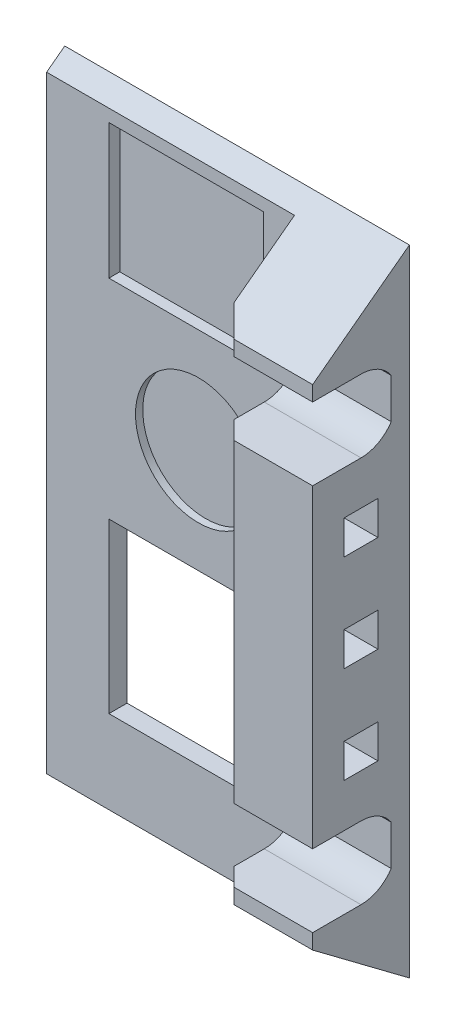
from build123d import *
from build123d.topology import SkipClean

# Parameters (mm, degrees)
ESBO_O1_R                 = 8.3
RESSALTO_EXTRUS_O1_DEPTH  = 1.5
RESSALTO_EXTRUS_O2_DEPTH  = 6
ESBO_O3_W                 = 2.8
ESBO_O3_H                 = 2.8
CORTE_EXTRUS_O1_DEPTH     = 37.142080737
ESBO_O4_W                 = 2.8
ESBO_O4_H                 = 2.8
CORTE_EXTRUS_O2_DEPTH     = 53.08166664
ESBO_O6_W                 = 5
ESBO_O6_H                 = 25
RESSALTO_EXTRUS_O5_DEPTH  = 7.5
ESBO_O7_W                 = 2.8
ESBO_O7_H                 = 2.8
CORTE_EXTRUS_O3_DEPTH     = 60
RESSALTO_EXTRUS_O3_DEPTH  = 10
ESBO_O8_W                 = 60
ESBO_O8_H                 = 52.5
ESBO_O8_R                 = 8.3
RESSALTO_EXTRUS_O6_DEPTH  = 1.5
CORTE_EXTRUS_O4_DEPTH     = 42.098205557
RESSALTO_EXTRUS_O7_DEPTH  = 6.5
ESBO_O14_W                = 5.7
ESBO_O14_H                = 52.5
CORTE_EXTRUS_O8_DEPTH     = 4.5
CORTE_EXTRUS_O9_DEPTH     = 41.657871317
CORTE_EXTRUS_O13_DEPTH    = 6.25
CORTE_EXTRUS_O14_DEPTH    = 6.25
ESBO_O12_R                = 1.65
CORTE_EXTRUS_O15_DEPTH    = 4.5
CORTE_EXTRUS_O17_DEPTH    = 62.398717413
ESBO_O20_R                = 3.5
CORTE_EXTRUS_O18_DEPTH    = 5
RESSALTO_EXTRUS_O8_START  = 2.95
ESBO_O21_R                = 1.65
RESSALTO_EXTRUS_O8_DEPTH  = 2.95
ESBO_O22_W                = 2.8
ESBO_O22_H                = 2.8
RESSALTO_EXTRUS_O9_DEPTH  = 1.25
CORTE_EXTRUS_O19_DEPTH    = 6
ESBO_O24_W                = 8
ESBO_O24_H                = 50.25
RESSALTO_EXTRUS_O10_DEPTH = 6.5
CORTE_EXTRUS_O20_DEPTH    = 62.222570389
CORTE_EXTRUS_O21_REACH    = 67.143
ESBO_O26_W                = 2.8
ESBO_O26_H                = 2.8
CORTE_EXTRUS_O22_REACH    = 67.143
CORTE_EXTRUS_O23_DEPTH    = 6.5
CORTE_EXTRUS_O24_DEPTH    = 6.5
CORTE_EXTRUS_O25_START    = -6.5
CORTE_EXTRUS_O25_DEPTH    = 6.5
CORTE_EXTRUS_O26_DEPTH    = 4.95
ESBO_O33_R                = 9.3
CORTE_EXTRUS_O27_DEPTH    = 43.019340785
ESBO_O34_R                = 8.3
RESSALTO_EXTRUS_O11_DEPTH = 1.5
ESBO_O49_R                = 41.403192139
CORTE_EXTRUS_O37_DEPTH    = 28.5
ESBO_O50_W                = 12.795
ESBO_O50_H                = 13.938
ESBO_O50_H_2              = 11.144
CORTE_EXTRUS_O38_DEPTH    = 42.588760501
ESBO_O51_R                = 5.2
CORTE_EXTRUS_O39_DEPTH    = 0.6
ESBO_O52_R                = 31.470560184
CORTE_EXTRUS_O40_DEPTH    = 1.5
ESBO_O54_R                = 5
ESBO_O54_R_2              = 3
CORTE_EXTRUS_O41_DEPTH    = 0.3
ESBO_O56_W                = 12.795
ESBO_O56_H                = 11.144
RESSALTO_EXTRUS_O13_DEPTH = 0.6
ESBO_O57_W                = 12.795
ESBO_O57_H                = 11.144
ESBO_O57_W_2              = 12.195
ESBO_O57_H_2              = 10.544
CORTE_EXTRUS_O44_DEPTH    = 0.3


with BuildPart() as part:
    # Esboço1 → Ressalto-extrusão1 (new body)
    with BuildSketch(Plane.XY):
        Polygon((-25, -12.5), (-25, 12.5), (25, 12.5), (25, -12.5), (15, -12.5), (-15, -12.5), align=None)
        with Locations((-13, 0)):
            Circle(ESBO_O1_R, mode=Mode.SUBTRACT)
        with Locations(Location((13, 0, 0), (0, 0, 180))):
            Circle(ESBO_O1_R, mode=Mode.SUBTRACT)
    extrude(amount=RESSALTO_EXTRUS_O1_DEPTH)

    # Esboço2 → Ressalto-extrusão2 (add)
    with BuildSketch(Plane.XY.offset(1.5)):
        Polygon((-20, -12.5), (-25, -12.5), (-25, -2.5), (-22, -2.5), (-22, -9.5), (-15, -9.5), (-15, -12.5), align=None)
        Polygon((22, -2.5), (22, -9.5), (15, -9.5), (15, -12.5), (20, -12.5), (25, -12.5), (25, -2.5), align=None)
        Polygon((20, 12.5), (25, 12.5), (25, 2.5), (22, 2.5), (22, 9.5), (15, 9.5), (15, 12.5), align=None)
        Polygon((-22, 2.5), (-22, 9.5), (-15, 9.5), (-15, 12.5), (-20, 12.5), (-25, 12.5), (-25, 2.5), align=None)
    extrude(amount=RESSALTO_EXTRUS_O2_DEPTH)

    # Esboço3 → Corte-extrusão1 (cut, through all)
    with BuildSketch(Plane.XZ.offset(12.5)):
        with Locations((-20, 3.75)):
            Rectangle(ESBO_O3_W, ESBO_O3_H)
        with Locations((20, 3.75)):
            Rectangle(ESBO_O3_W, ESBO_O3_H)
    extrude(amount=-CORTE_EXTRUS_O1_DEPTH, mode=Mode.SUBTRACT)

    # Esboço4 → Corte-extrusão2 (cut, through all)
    with BuildSketch(Plane.ZY.offset(25)):
        with Locations((3.75, 7.5)):
            Rectangle(ESBO_O4_W, ESBO_O4_H)
        with Locations((3.75, -7.5)):
            Rectangle(ESBO_O4_W, ESBO_O4_H)
    extrude(amount=-CORTE_EXTRUS_O2_DEPTH, mode=Mode.SUBTRACT)

    # Esboço6 → Ressalto-extrusão5 (add)
    with BuildSketch(Plane(origin=(0, 0, 0), x_dir=(-1, 0, 0), z_dir=(0, 0, -1))):
        with Locations((-27.5, 0)):
            Rectangle(ESBO_O6_W, ESBO_O6_H)
        with Locations((27.5, 0)):
            Rectangle(ESBO_O6_W, ESBO_O6_H)
    extrude(amount=-RESSALTO_EXTRUS_O5_DEPTH)

    # Esboço7 → Corte-extrusão3 (cut)
    with BuildSketch(Plane(origin=(30, 0, 0), x_dir=(0, 0, -1), z_dir=(1, 0, 0))):
        with Locations((-3.75, -7.5)):
            Rectangle(ESBO_O7_W, ESBO_O7_H)
        with Locations((-3.75, 7.5)):
            Rectangle(ESBO_O7_W, ESBO_O7_H)
    extrude(amount=-CORTE_EXTRUS_O3_DEPTH, mode=Mode.SUBTRACT)

    # Esboço5 → Ressalto-extrusão3 (add)
    with SkipClean():  # the faces are left unmerged after this step: merging them gives an invalid solid
        with BuildSketch(Plane.XY.offset(1.5)):
            with BuildLine():
                Line((-9, -7.272551134), (-9, -8.395832299))
                ThreePointArc((-9, -8.395832299), (-3.7, 0), (-9, 8.395832299))
                Line((-9, 8.395832299), (-9, 7.272551134))
                ThreePointArc((-9, 7.272551134), (-4.7, 0), (-9, -7.272551134))
            make_face()
            with BuildLine():
                Line((-17, -7.272551134), (-17, -8.395832299))
                ThreePointArc((-17, -8.395832299), (-22.3, 0), (-17, 8.395832299))
                Line((-17, 8.395832299), (-17, 7.272551134))
                ThreePointArc((-17, 7.272551134), (-21.3, 0), (-17, -7.272551134))
            make_face()
            with BuildLine():
                Line((9, -7.272551134), (9, -8.395832299))
                ThreePointArc((9, -8.395832299), (3.7, 0), (9, 8.395832299))
                Line((9, 8.395832299), (9, 7.272551134))
                ThreePointArc((9, 7.272551134), (4.7, 0), (9, -7.272551134))
            make_face()
            with BuildLine():
                Line((17, 8.395832299), (17, 7.272551134))
                ThreePointArc((17, 7.272551134), (21.3, 0), (17, -7.272551134))
                Line((17, -7.272551134), (17, -8.395832299))
                ThreePointArc((17, -8.395832299), (22.3, 0), (17, 8.395832299))
            make_face()
        extrude(amount=RESSALTO_EXTRUS_O3_DEPTH)

    # Esboço8 → Ressalto-extrusão6 (add)
    with SkipClean():  # the faces are left unmerged after this step: merging them gives an invalid solid
        with BuildSketch(Plane(origin=(0, 0, 0), x_dir=(-1, 0, 0), z_dir=(0, 0, -1))):
            Rectangle(ESBO_O8_W, ESBO_O8_H)
            with Locations(Location((13, 0, 0), (0, 0, 298.811379709))):
                Circle(ESBO_O8_R, mode=Mode.SUBTRACT)
            with Locations((-13, 0)):
                Circle(ESBO_O8_R, mode=Mode.SUBTRACT)
        extrude(amount=-RESSALTO_EXTRUS_O6_DEPTH)

    # Esboço9 → Corte-extrusão4 (cut, through all)
    with SkipClean():  # the faces are left unmerged after this step: merging them gives an invalid solid
        with BuildSketch(Plane.XY.offset(1.5)):
            Polygon((-15, -12.5), (-15, -9.5), (-22, -9.5), (-22, -2.5), (-25, -2.5), (-25, 2.5), (-22, 2.5), (-22, 9.5), (-15, 9.5), (-15, 12.5), (-30, 12.5), (-30, -12.5), align=None)
        extrude(amount=CORTE_EXTRUS_O4_DEPTH, mode=Mode.SUBTRACT)

    # Esboço10 → Ressalto-extrusão7 (add)
    with SkipClean():  # the faces are left unmerged after this step: merging them gives an invalid solid
        with BuildSketch(Plane.XY.offset(1.5)):
            Polygon((-24.3, -26.25), (-24.3, 26.25), (-22.3, 26.25), (-17.3, 26.25), (-17.3, 20), (-22.3, 20), (-22.3, 12), (-17.3, 12), (-17.3, -12), (-22.3, -12), (-22.3, -20), (-17.3, -20), (-17.3, -26.25), (-22.3, -26.25), align=None)
        extrude(amount=RESSALTO_EXTRUS_O7_DEPTH)

    # Esboço14 → Corte-extrusão8 (cut)
    with SkipClean():  # the faces are left unmerged after this step: merging them gives an invalid solid
        with BuildSketch(Plane.XY.offset(1.5)):
            with Locations((-27.15, 0)):
                Rectangle(ESBO_O14_W, ESBO_O14_H)
        extrude(amount=-CORTE_EXTRUS_O8_DEPTH, mode=Mode.SUBTRACT)

    # Esboço15 → Corte-extrusão9 (cut, through all)
    with SkipClean():  # the faces are left unmerged after this step: merging them gives an invalid solid
        with BuildSketch(Plane.XY.offset(8)):
            with BuildLine():
                Line((-17.3, -7.09929574), (-17.3, 7.09929574))
                ThreePointArc((-17.3, 7.09929574), (-21.3, 0), (-17.3, -7.09929574))
            make_face()
        extrude(amount=-CORTE_EXTRUS_O9_DEPTH, mode=Mode.SUBTRACT)

    # Esboço11 → Corte-extrusão13 (cut)
    with SkipClean():  # the faces are left unmerged after this step: merging them gives an invalid solid
        with BuildSketch(Plane.XZ.offset(26.25)):
            Polygon((-22.3, 8), (-17.3, 8), (-17.3, 1.5), align=None)
        extrude(amount=-CORTE_EXTRUS_O13_DEPTH, mode=Mode.SUBTRACT)

    # Esboço17 → Corte-extrusão14 (cut)
    with SkipClean():  # the faces are left unmerged after this step: merging them gives an invalid solid
        with BuildSketch(Plane(origin=(0, 26.25, 0), x_dir=(1, 0, 0), z_dir=(0, 1, 0))):
            Polygon((-17.3, -1.5), (-17.3, -8), (-22.3, -8), align=None)
        extrude(amount=-CORTE_EXTRUS_O14_DEPTH, mode=Mode.SUBTRACT)

    # Esboço12 → Corte-extrusão15 (cut)
    with SkipClean():  # the faces are left unmerged after this step: merging them gives an invalid solid
        with BuildSketch(Plane.ZY.offset(24.3)):
            with Locations(Location((4, 16, 0), (0, 0, 270))):
                Circle(ESBO_O12_R)
            with Locations((4, -16)):
                Circle(ESBO_O12_R)
        extrude(amount=-CORTE_EXTRUS_O15_DEPTH, mode=Mode.SUBTRACT)

    # Esboço19 → Corte-extrusão17 (cut, through all)
    with SkipClean():  # the faces are left unmerged after this step: merging them gives an invalid solid
        with BuildSketch(Plane.ZY.offset(24.3)):
            Polygon((0, 26.25), (8, 26.25), (8, 20.25), align=None)
            Polygon((8, -20.25), (0, -26.25), (8, -26.25), align=None)
        extrude(amount=-CORTE_EXTRUS_O17_DEPTH, mode=Mode.SUBTRACT)

    # Esboço20 → Corte-extrusão18 (cut)
    with SkipClean():  # the faces are left unmerged after this step: merging them gives an invalid solid
        with BuildSketch(Plane(origin=(-22.3, 0, 0), x_dir=(0, 0, -1), z_dir=(1, 0, 0))):
            with Locations((-4, -16)):
                Circle(ESBO_O20_R)
            with Locations((-4, 16)):
                Circle(ESBO_O20_R)
        extrude(amount=CORTE_EXTRUS_O18_DEPTH, mode=Mode.SUBTRACT)

    # Esboço21 → Ressalto-extrusão8 (add)
    with SkipClean():  # the faces are left unmerged after this step: merging them gives an invalid solid
        with BuildSketch(Plane.ZY.offset(24.3).offset(RESSALTO_EXTRUS_O8_START)):
            Polygon((0, 26.25), (0, -26.25), (8, -20.25), (8, 20.25), align=None)
            with Locations(Location((4, -16, 0), (0, 0, 270))):
                Circle(ESBO_O21_R, mode=Mode.SUBTRACT)
            with Locations(Location((4, 16, 0), (0, 0, 270))):
                Circle(ESBO_O21_R, mode=Mode.SUBTRACT)
        extrude(amount=-RESSALTO_EXTRUS_O8_DEPTH)

    # Esboço22 → Ressalto-extrusão9 (add)
    with SkipClean():  # the faces are left unmerged after this step: merging them gives an invalid solid
        with BuildSketch(Plane(origin=(30, 0, 0), x_dir=(0, 0, -1), z_dir=(1, 0, 0))):
            Polygon((-1.5, -25.125), (0, -26.25), (0, 26.25), (-1.5, 25.125), (-1.5, 12.5), (-7.5, 12.5), (-7.5, -12.5), (-1.5, -12.5), align=None)
            with Locations((-3.75, -7.5)):
                Rectangle(ESBO_O22_W, ESBO_O22_H, mode=Mode.SUBTRACT)
            with Locations((-3.75, 7.5)):
                Rectangle(ESBO_O22_W, ESBO_O22_H, mode=Mode.SUBTRACT)
        extrude(amount=RESSALTO_EXTRUS_O9_DEPTH)

    # Esboço23 → Corte-extrusão19 (cut)
    with SkipClean():  # the faces are left unmerged after this step: merging them gives an invalid solid
        with BuildSketch(Plane.XY.offset(7.5)):
            Polygon((25, -2.5), (22, -2.5), (22, -9.5), (15, -9.5), (15, -12.5), (31.25, -12.5), (31.25, 12.5), (15, 12.5), (15, 9.5), (22, 9.5), (22, 2.5), (25, 2.5), align=None)
        extrude(amount=-CORTE_EXTRUS_O19_DEPTH, mode=Mode.SUBTRACT)

    # Esboço24 → Ressalto-extrusão10 (add)
    with SkipClean():  # the faces are left unmerged after this step: merging them gives an invalid solid
        with BuildSketch(Plane.XY.offset(1.5)):
            with Locations((27.25, 0)):
                Rectangle(ESBO_O24_W, ESBO_O24_H)
        extrude(amount=RESSALTO_EXTRUS_O10_DEPTH)

    # Esboço25 → Corte-extrusão20 (cut, through all)
    with SkipClean():  # the faces are left unmerged after this step: merging them gives an invalid solid
        with BuildSketch(Plane(origin=(0, 25.125, 0), x_dir=(1, 0, 0), z_dir=(0, 1, 0))):
            Polygon((23.25, -6.5), (23.25, -8), (24.75, -8), align=None)
        extrude(amount=-CORTE_EXTRUS_O20_DEPTH, mode=Mode.SUBTRACT)

    # Esboço26 → Corte-extrusão21 (cut, up to next)
    with BuildSketch(Plane(origin=(31.25, 0, 0), x_dir=(0, 0, -1), z_dir=(1, 0, 0)), mode=Mode.PRIVATE) as corte_extrus_o21_sk1:
        with Locations((-4, 0)):
            Rectangle(ESBO_O26_W, ESBO_O26_H)
    corte_extrus_o21_tool1 = extrude(corte_extrus_o21_sk1.sketch, amount=-CORTE_EXTRUS_O21_REACH, mode=Mode.PRIVATE) & part.part
    # Esboço26 → Corte-extrusão21 (cut, up to next)
    with BuildSketch(Plane(origin=(31.25, 0, 0), x_dir=(0, 0, -1), z_dir=(1, 0, 0)), mode=Mode.PRIVATE) as corte_extrus_o21_sk2:
        with Locations((-4, -8)):
            Rectangle(ESBO_O26_W, ESBO_O26_H)
    corte_extrus_o21_tool2 = extrude(corte_extrus_o21_sk2.sketch, amount=-CORTE_EXTRUS_O21_REACH, mode=Mode.PRIVATE) & part.part
    # Esboço26 → Corte-extrusão21 (cut, up to next)
    with BuildSketch(Plane(origin=(31.25, 0, 0), x_dir=(0, 0, -1), z_dir=(1, 0, 0)), mode=Mode.PRIVATE) as corte_extrus_o21_sk3:
        with Locations((-4, 8)):
            Rectangle(ESBO_O26_W, ESBO_O26_H)
    corte_extrus_o21_tool3 = extrude(corte_extrus_o21_sk3.sketch, amount=-CORTE_EXTRUS_O21_REACH, mode=Mode.PRIVATE) & part.part
    add(corte_extrus_o21_tool1.solids().sort_by_distance((31.25, 0, 4))[0], mode=Mode.SUBTRACT)
    add(corte_extrus_o21_tool2.solids().sort_by_distance((31.25, -8, 4))[0], mode=Mode.SUBTRACT)
    add(corte_extrus_o21_tool3.solids().sort_by_distance((31.25, 8, 4))[0], mode=Mode.SUBTRACT)

    # Esboço27 → Corte-extrusão22 (cut, up to next)
    with BuildSketch(Plane(origin=(31.25, 0, 0), x_dir=(0, 0, -1), z_dir=(1, 0, 0)), mode=Mode.PRIVATE) as corte_extrus_o22_sk1:
        with BuildLine():
            Line((-4, 19), (-8, 19))
            Line((-8, 19), (-8, 13))
            Line((-8, 13), (-4, 13))
            ThreePointArc((-4, 13), (-2.581362835, 13.356617963), (-1.5, 14.341687605))
            Line((-1.5, 14.341687605), (-1.5, 17.658312395))
            ThreePointArc((-1.5, 17.658312395), (-2.581362835, 18.643382037), (-4, 19))
        make_face()
    corte_extrus_o22_tool1 = extrude(corte_extrus_o22_sk1.sketch, amount=-CORTE_EXTRUS_O22_REACH, mode=Mode.PRIVATE) & part.part
    # Esboço27 → Corte-extrusão22 (cut, up to next)
    with BuildSketch(Plane(origin=(31.25, 0, 0), x_dir=(0, 0, -1), z_dir=(1, 0, 0)), mode=Mode.PRIVATE) as corte_extrus_o22_sk2:
        Polygon((-8, -20.25), (-8, -25.125), (-1.5, -25.125), align=None)
    corte_extrus_o22_tool2 = extrude(corte_extrus_o22_sk2.sketch, amount=-CORTE_EXTRUS_O22_REACH, mode=Mode.PRIVATE) & part.part
    # Esboço27 → Corte-extrusão22 (cut, up to next)
    with BuildSketch(Plane(origin=(31.25, 0, 0), x_dir=(0, 0, -1), z_dir=(1, 0, 0)), mode=Mode.PRIVATE) as corte_extrus_o22_sk3:
        Polygon((-8, 25.125), (-8, 20.25), (-1.5, 25.125), align=None)
    corte_extrus_o22_tool3 = extrude(corte_extrus_o22_sk3.sketch, amount=-CORTE_EXTRUS_O22_REACH, mode=Mode.PRIVATE) & part.part
    # Esboço27 → Corte-extrusão22 (cut, up to next)
    with BuildSketch(Plane(origin=(31.25, 0, 0), x_dir=(0, 0, -1), z_dir=(1, 0, 0)), mode=Mode.PRIVATE) as corte_extrus_o22_sk4:
        with BuildLine():
            Line((-4, -13), (-8, -13))
            Line((-8, -13), (-8, -19))
            Line((-8, -19), (-4, -19))
            ThreePointArc((-4, -19), (-2.581362835, -18.643382037), (-1.5, -17.658312395))
            Line((-1.5, -17.658312395), (-1.5, -14.341687605))
            ThreePointArc((-1.5, -14.341687605), (-2.581362835, -13.356617963), (-4, -13))
        make_face()
    corte_extrus_o22_tool4 = extrude(corte_extrus_o22_sk4.sketch, amount=-CORTE_EXTRUS_O22_REACH, mode=Mode.PRIVATE) & part.part
    add(corte_extrus_o22_tool1.solids().sort_by_distance((31.25, 16, 4.892695))[0], mode=Mode.SUBTRACT)
    add(corte_extrus_o22_tool2.solids().sort_by_distance((31.25, -23.5, 5.833333))[0], mode=Mode.SUBTRACT)
    add(corte_extrus_o22_tool3.solids().sort_by_distance((31.25, 23.5, 5.833333))[0], mode=Mode.SUBTRACT)
    add(corte_extrus_o22_tool4.solids().sort_by_distance((31.25, -16, 4.892695))[0], mode=Mode.SUBTRACT)

    # Esboço28 → Corte-extrusão23 (cut)
    with SkipClean():  # the faces are left unmerged after this step: merging them gives an invalid solid
        with BuildSketch(Plane.XY.offset(8)):
            with BuildLine():
                Line((-27.25, 12), (-27.25, -12))
                Line((-27.25, -12), (-24.8, -12))
                ThreePointArc((-24.8, -12), (-23.032233047, -11.267766953), (-22.3, -9.5))
                Line((-22.3, -9.5), (-22.3, 9.5))
                ThreePointArc((-22.3, 9.5), (-23.032233047, 11.267766953), (-24.8, 12))
                Line((-24.8, 12), (-27.25, 12))
            make_face()
        extrude(amount=-CORTE_EXTRUS_O23_DEPTH, mode=Mode.SUBTRACT)

    # Esboço29 → Corte-extrusão24 (cut)
    with SkipClean():  # the faces are left unmerged after this step: merging them gives an invalid solid
        with BuildSketch(Plane.XY.offset(8)):
            with BuildLine():
                Line((-19.8, -12), (-19.8, -12.44923286))
                Line((-19.8, -12.44923286), (-19.8, -14.139655276))
                Line((-19.8, -14.139655276), (-15.225886581, -14.139655276))
                Line((-15.225886581, -14.139655276), (-15.225886581, -9.5))
                Line((-15.225886581, -9.5), (-17.3, -9.5))
                ThreePointArc((-17.3, -9.5), (-18.032233047, -11.267766953), (-19.8, -12))
            make_face()
            with BuildLine():
                Line((-19.8, 12), (-19.8, 12.907103379))
                Line((-19.8, 12.907103379), (-15.750500434, 12.907103379))
                Line((-15.750500434, 12.907103379), (-15.750500434, 9.5))
                Line((-15.750500434, 9.5), (-17.3, 9.5))
                ThreePointArc((-17.3, 9.5), (-18.032233047, 11.267766953), (-19.8, 12))
            make_face()
        extrude(amount=-CORTE_EXTRUS_O24_DEPTH, mode=Mode.SUBTRACT)

    # Esboço30 → Corte-extrusão25 (cut)
    with SkipClean():  # the faces are left unmerged after this step: merging them gives an invalid solid
        with BuildSketch(Plane.XY.offset(8).offset(CORTE_EXTRUS_O25_START)):
            with BuildLine():
                Line((-27.25, 12), (-17, 12))
                Line((-17, 12), (-17, 8.395832299))
                ThreePointArc((-17, 8.395832299), (-22.3, 0), (-17, -8.395832299))
                Line((-17, -8.395832299), (-17, -12))
                Line((-17, -12), (-27.25, -12))
                Line((-27.25, -12), (-27.25, 12))
            make_face()
        extrude(amount=CORTE_EXTRUS_O25_DEPTH, mode=Mode.SUBTRACT)

    # Esboço31 → Corte-extrusão26 (cut)
    with SkipClean():  # the faces are left unmerged after this step: merging them gives an invalid solid
        with BuildSketch(Plane.ZY.offset(27.25)):
            with BuildLine():
                Line((5.5, -12), (8, -12))
                Line((8, -12), (8, -14.5))
                ThreePointArc((8, -14.5), (7.267766953, -12.732233047), (5.5, -12))
            make_face()
            with BuildLine():
                Line((5.5, 12), (8, 12))
                Line((8, 12), (8, 14.5))
                ThreePointArc((8, 14.5), (7.267766953, 12.732233047), (5.5, 12))
            make_face()
        extrude(amount=-CORTE_EXTRUS_O26_DEPTH, mode=Mode.SUBTRACT)

    # Esboço33 → Corte-extrusão27 (cut, through all)
    with BuildSketch(Plane.XY.offset(1.5)):
        with Locations((13, 0)):
            Circle(ESBO_O33_R)
        with Locations((-13, 0)):
            Circle(ESBO_O33_R)
    extrude(amount=CORTE_EXTRUS_O27_DEPTH, mode=Mode.SUBTRACT)

    # Esboço34 → Ressalto-extrusão11 (add)
    with BuildSketch(Plane(origin=(0, 0, 0), x_dir=(-1, 0, 0), z_dir=(0, 0, -1))):
        with Locations((-13, 0)):
            Circle(ESBO_O34_R)
        with Locations((13, 0)):
            Circle(ESBO_O34_R)
    extrude(amount=-RESSALTO_EXTRUS_O11_DEPTH)

    # Esboço49 → Corte-extrusão37 (cut)
    with BuildSketch(Plane.ZY.offset(27.25)):
        Circle(ESBO_O49_R)
    extrude(amount=-CORTE_EXTRUS_O37_DEPTH, mode=Mode.SUBTRACT)

    # Esboço50 → Corte-extrusão38 (cut, through all)
    with BuildSketch(Plane(origin=(0, 0, 0), x_dir=(-1, 0, 0), z_dir=(0, 0, -1))):
        with Locations((-14.2985, -11.271349979)):
            Rectangle(ESBO_O50_W, ESBO_O50_H)
        with Locations((-14.2985, 18.522850021)):
            Rectangle(ESBO_O50_W, ESBO_O50_H_2)
    extrude(amount=-CORTE_EXTRUS_O38_DEPTH, mode=Mode.SUBTRACT)

    # Esboço51 → Corte-extrusão39 (cut)
    with BuildSketch(Plane.XY.offset(1.5)):
        with Locations((15.2985, 4.324250021)):
            Circle(ESBO_O51_R)
    extrude(amount=-CORTE_EXTRUS_O39_DEPTH, mode=Mode.SUBTRACT)

    # Esboço52 → Corte-extrusão40 (cut)
    with BuildSketch(Plane.ZY.offset(-1.25)):
        Circle(ESBO_O52_R)
    extrude(amount=-CORTE_EXTRUS_O40_DEPTH, mode=Mode.SUBTRACT)

    # Esboço54 → Corte-extrusão41 (cut)
    with BuildSketch(Plane(origin=(0, 0, 0), x_dir=(-1, 0, 0), z_dir=(0, 0, -1))):
        with Locations((-15.2985, 4.324250021)):
            Circle(ESBO_O54_R)
        with Locations((-15.2985, 4.324250021)):
            Circle(ESBO_O54_R_2, mode=Mode.SUBTRACT)
    extrude(amount=-CORTE_EXTRUS_O41_DEPTH, mode=Mode.SUBTRACT)

    # Esboço56 → Ressalto-extrusão13 (add)
    with BuildSketch(Plane(origin=(0, 0, 0), x_dir=(-1, 0, 0), z_dir=(0, 0, -1))):
        with Locations((-14.2985, 18.522850021)):
            Rectangle(ESBO_O56_W, ESBO_O56_H)
    extrude(amount=-RESSALTO_EXTRUS_O13_DEPTH)

    # Esboço57 → Corte-extrusão44 (cut)
    with BuildSketch(Plane.XY):
        with Locations((14.2985, 18.522850021)):
            Rectangle(ESBO_O57_W, ESBO_O57_H)
        with Locations((14.2985, 18.522850021)):
            Rectangle(ESBO_O57_W_2, ESBO_O57_H_2, mode=Mode.SUBTRACT)
    extrude(amount=CORTE_EXTRUS_O44_DEPTH, mode=Mode.SUBTRACT)


solid = part.part
